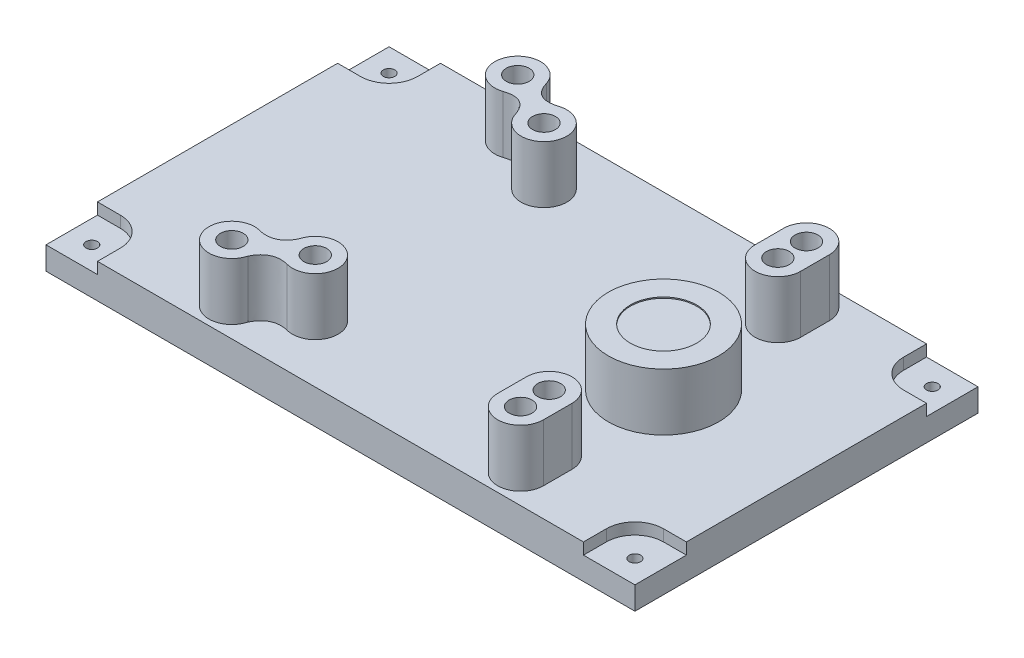
from build123d import *

# Parameters (mm, degrees)
SKETCH2_W           = 103
SKETCH2_H           = 60
BOSS_EXTRUDE1_DEPTH = 6
SKETCH3_R           = 9.65
SKETCH3_R_2         = 2
BOSS_EXTRUDE2_DEPTH = 10
CUT_EXTRUDE1_DEPTH  = 2
SKETCH6_R           = 1
CUT_EXTRUDE2_DEPTH  = 120.804006757
SKETCH7_R           = 5.8
CUT_EXTRUDE3_DEPTH  = 0.2


with BuildPart() as part:
    # Sketch2 → Boss-Extrude1 (new body)
    with BuildSketch(Plane(origin=(0, 0, 0), x_dir=(1, 0, 0), z_dir=(0, 1, 0))):
        with Locations((51.5, 30)):
            Rectangle(SKETCH2_W, SKETCH2_H)
    extrude(amount=BOSS_EXTRUDE1_DEPTH)

    # Sketch3 → Boss-Extrude2 (add)
    # profile 1 of 5: a face of its own
    with BuildSketch(Plane(origin=(0, 6, 0), x_dir=(1, 0, 0), z_dir=(0, 1, 0))):
        with Locations(Location((78, 30, 0), (0, 0, 90))):
            Circle(SKETCH3_R)
    # profile 2 of 5: a face of its own
    with BuildSketch(Plane(origin=(0, 6, 0), x_dir=(1, 0, 0), z_dir=(0, 1, 0))):
        with BuildLine():
            Line((74, 55), (74, 50))
            ThreePointArc((74, 50), (78, 46), (82, 50))
            Line((82, 50), (82, 55))
            ThreePointArc((82, 55), (78, 59), (74, 55))
        make_face()
        with Locations(Location((78, 55, 0), (0, 0, 270))):
            Circle(SKETCH3_R_2, mode=Mode.SUBTRACT)
        with Locations(Location((78, 50, 0), (0, 0, 270))):
            Circle(SKETCH3_R_2, mode=Mode.SUBTRACT)
    # profile 3 of 5: a face of its own
    with BuildSketch(Plane(origin=(0, 6, 0), x_dir=(1, 0, 0), z_dir=(0, 1, 0))):
        with BuildLine():
            Line((74, 10), (74, 5))
            ThreePointArc((74, 5), (78, 1), (82, 5))
            Line((82, 5), (82, 10))
            ThreePointArc((82, 10), (78, 14), (74, 10))
        make_face()
        with Locations(Location((78, 10, 0), (0, 0, 270))):
            Circle(SKETCH3_R_2, mode=Mode.SUBTRACT)
        with Locations(Location((78, 5, 0), (0, 0, 270))):
            Circle(SKETCH3_R_2, mode=Mode.SUBTRACT)
    # profile 4 of 5: a face of its own
    with BuildSketch(Plane(origin=(0, 6, 0), x_dir=(1, 0, 0), z_dir=(0, 1, 0))):
        with BuildLine():
            ThreePointArc((28.84758707, 8.766166365), (23.953123955, 3.150764937), (31.359338334, 3.948568773))
            add(Edge.make_bspline(
                [(31.359338334, 3.948568773), (32.83524335, 6.912030452), (36.017562261, 6.146478651)],
                knots=[0, 0, 0, 1, 1, 1], degree=2))
            ThreePointArc((36.017562261, 6.146478651), (40.636992833, 11.849235063), (33.316625669, 11.326938122))
            add(Edge.make_bspline(
                [(28.84758707, 8.766166365), (32.122274454, 8.279521447), (33.316625669, 11.326938122)],
                knots=[0, 0, 0, 1, 1, 1], degree=2))
        make_face()
        with Locations(Location((37.090116788, 10, 0), (0, 0, 270))):
            Circle(SKETCH3_R_2, mode=Mode.SUBTRACT)
        with Locations(Location((27.5, 5, 0), (0, 0, 270))):
            Circle(SKETCH3_R_2, mode=Mode.SUBTRACT)
    # profile 5 of 5: a face of its own
    with BuildSketch(Plane(origin=(0, 6, 0), x_dir=(1, 0, 0), z_dir=(0, 1, 0))):
        with BuildLine():
            add(Edge.make_bspline(
                [(31.355779837, 56.064406805), (32.362019475, 52.752034899), (35.895571064, 53.817467814)],
                knots=[0.017920477, 0.017920477, 0.017920477, 1, 1, 1], degree=2))
            add(Edge.make_bspline(
                [(31.319898681, 56.18674937), (31.337418499, 56.124849248), (31.355779837, 56.064406805)],
                knots=[0, 0, 0, 0.017920477, 0.017920477, 0.017920477], degree=2))
            ThreePointArc((31.319898681, 56.18674937), (23.953123955, 56.849235063), (28.714062153, 51.188694044))
            add(Edge.make_bspline(
                [(28.714062153, 51.188694044), (28.774843392, 51.209770338), (28.83491132, 51.229322108)],
                knots=[0, 0, 0, 0.017920477, 0.017920477, 0.017920477], degree=2))
            add(Edge.make_bspline(
                [(28.83491132, 51.229322108), (32.126759022, 52.300799854), (33.276340108, 48.793721661)],
                knots=[0.017920477, 0.017920477, 0.017920477, 1, 1, 1], degree=2))
            ThreePointArc((33.276340108, 48.793721661), (40.636992833, 48.150764937), (35.895571064, 53.817467814))
        make_face()
        with Locations(Location((37.090116788, 50, 0), (0, 0, 270))):
            Circle(SKETCH3_R_2, mode=Mode.SUBTRACT)
        with Locations(Location((27.5, 55, 0), (0, 0, 270))):
            Circle(SKETCH3_R_2, mode=Mode.SUBTRACT)
    extrude(amount=BOSS_EXTRUDE2_DEPTH)

    # Sketch5 → Cut-Extrude1 (cut)
    with BuildSketch(Plane(origin=(0, 6, 0), x_dir=(1, 0, 0), z_dir=(0, 1, 0))):
        with BuildLine():
            Line((9, 0), (0, 0))
            Line((0, 0), (0, 9))
            Line((0, 9), (4, 9))
            ThreePointArc((4, 9), (7.535533906, 7.535533906), (9, 4))
            Line((9, 4), (9, 0))
        make_face()
        with BuildLine():
            Line((0, 60), (0, 51))
            Line((0, 51), (4, 51))
            ThreePointArc((4, 51), (7.535533906, 52.464466094), (9, 56))
            Line((9, 56), (9, 60))
            Line((9, 60), (0, 60))
        make_face()
        with BuildLine():
            Line((94, 60), (103, 60))
            Line((103, 60), (103, 51))
            Line((103, 51), (99, 51))
            ThreePointArc((99, 51), (95.464466094, 52.464466094), (94, 56))
            Line((94, 56), (94, 60))
        make_face()
        with BuildLine():
            Line((103, 0), (103, 9))
            Line((103, 9), (99, 9))
            ThreePointArc((99, 9), (95.464466094, 7.535533906), (94, 4))
            Line((94, 4), (94, 0))
            Line((94, 0), (103, 0))
        make_face()
    extrude(amount=-CUT_EXTRUDE1_DEPTH, mode=Mode.SUBTRACT)

    # Sketch6 → Cut-Extrude2 (cut, through all)
    with BuildSketch(Plane(origin=(0, 4, 0), x_dir=(1, 0, 0), z_dir=(0, 1, 0))):
        with Locations(Location((4, 4, 0), (0, 0, 270))):
            Circle(SKETCH6_R)
        with Locations(Location((4, 56, 0), (0, 0, 270))):
            Circle(SKETCH6_R)
        with Locations(Location((99, 56, 0), (0, 0, 270))):
            Circle(SKETCH6_R)
        with Locations(Location((99, 4, 0), (0, 0, 270))):
            Circle(SKETCH6_R)
    extrude(amount=-CUT_EXTRUDE2_DEPTH, mode=Mode.SUBTRACT)

    # Sketch7 → Cut-Extrude3 (cut)
    with BuildSketch(Plane(origin=(0, 16, 0), x_dir=(1, 0, 0), z_dir=(0, 1, 0))):
        with Locations(Location((78, 30, 0), (0, 0, 270))):
            Circle(SKETCH7_R)
    extrude(amount=-CUT_EXTRUDE3_DEPTH, mode=Mode.SUBTRACT)


solid = part.part
